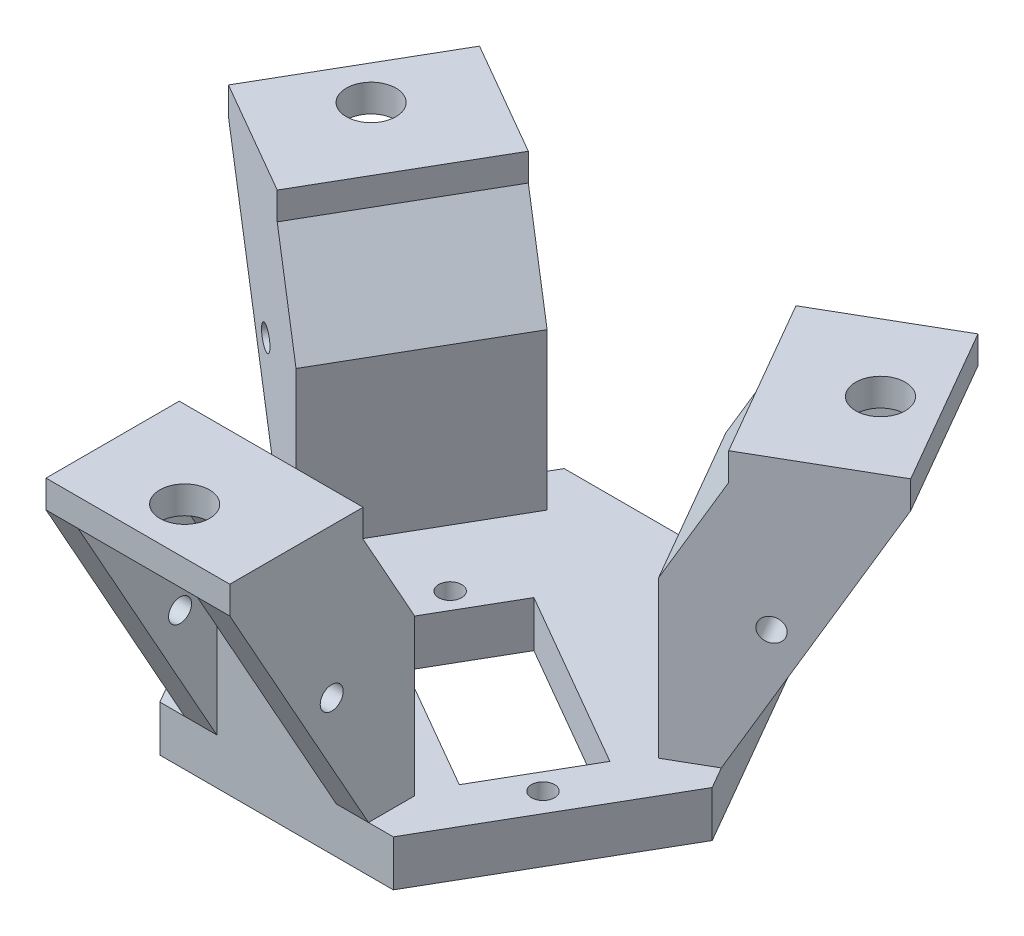
from build123d import *

# Parameters (mm, degrees)
BOSS_EXTRUDE1_DEPTH         = 5
SKETCH4_W                   = 20
SKETCH4_H                   = 5
BOSS_EXTRUDE3_DEPTH         = 17
BOSS_EXTRUDE2_START         = 6.5
SKETCH2_R                   = 1.25
BOSS_EXTRUDE2_DEPTH         = 3.5
CIRPATTERN1_COUNT           = 3
CIRPATTERN1_COPY_1_SKETCH_W = 20
CIRPATTERN1_COPY_1_SKETCH_H = 5
CIRPATTERN1_COPY_1_DEPTH    = 17
CIRPATTERN1_COPY_2_SKETCH_W = 20
CIRPATTERN1_COPY_2_SKETCH_H = 5
CIRPATTERN1_COPY_2_DEPTH    = 17
CIRPATTERN1_START           = 6.5
CIRPATTERN1_COPY_3_SKETCH_R = 1.25
CIRPATTERN1_COPY_3_DEPTH    = 3.5
CIRPATTERN1_COPY_4_SKETCH_R = 1.25
CIRPATTERN1_COPY_4_DEPTH    = 3.5
CUT_EXTRUDE1_REACH          = 50.2
CUT_EXTRUDE2_REACH          = 50.2
SKETCH6_R                   = 1.25
BOSS_EXTRUDE4_DEPTH         = 3
CUT_EXTRUDE3_REACH          = 61.959
SKETCH13_R                  = 2.7
CIRPATTERN2_COUNT           = 3


with BuildPart() as part:
    # Sketch1 → Boss-Extrude1 (new body)
    with BuildSketch(Plane(origin=(0, 0, 0), x_dir=(1, 0, 0), z_dir=(0, 1, 0))):
        Polygon((25.403411844, 0), (12.701705922, 22), (-12.701705922, 22), (-25.403411844, 0), (-12.701705922, -22), (12.701705922, -22), align=None)
    extrude(amount=BOSS_EXTRUDE1_DEPTH)

    # Sketch4 → Boss-Extrude3 (add)
    with BuildSketch(Plane(origin=(0, 5, 0), x_dir=(1, 0, 0), z_dir=(0, 1, 0))):
        with Locations((0, -19.5)):
            Rectangle(SKETCH4_W, SKETCH4_H)
    boss_extrude3 = extrude(amount=BOSS_EXTRUDE3_DEPTH)

    # Sketch2 → Boss-Extrude2 (add)
    with BuildSketch(Plane(origin=(0, 0, 0), x_dir=(0, 0, -1), z_dir=(1, 0, 0)).offset(BOSS_EXTRUDE2_START)):
        Polygon((-22, 22), (-22, 5), (-31.5, 22), align=None)
        with Locations(Location((-26, 18.75, 0), (0, 0, 180))):
            Circle(SKETCH2_R, mode=Mode.SUBTRACT)
    boss_extrude2 = extrude(amount=BOSS_EXTRUDE2_DEPTH)

    # Mirror1: Boss-Extrude3, Boss-Extrude2 across plane
    add(boss_extrude3.mirror(Plane(origin=(0, 0, 0), x_dir=(0, 0, 1), z_dir=(1, 0, 0))))
    add(boss_extrude2.mirror(Plane(origin=(0, 0, 0), x_dir=(0, 0, 1), z_dir=(1, 0, 0))))

    # CirPattern1: Boss-Extrude3, Boss-Extrude2 ×3 about axis
    cirpattern1_axis = Axis((0, 0, 0), (0, 1, 0))
    add([boss_extrude3.rotate(cirpattern1_axis, i * 360 / CIRPATTERN1_COUNT) for i in range(1, CIRPATTERN1_COUNT)])
    add([boss_extrude2.rotate(cirpattern1_axis, i * 360 / CIRPATTERN1_COUNT) for i in range(1, CIRPATTERN1_COUNT)])

    # CirPattern1 copy 1 sketch → CirPattern1 copy 1 (add)
    with BuildSketch(Plane(origin=(0, 5, 0), x_dir=(0.4999999999999998, 0, 0.8660254037844387), z_dir=(0, 1, 0))):
        with Locations((0, 19.5)):
            Rectangle(CIRPATTERN1_COPY_1_SKETCH_W, CIRPATTERN1_COPY_1_SKETCH_H)
    extrude(amount=CIRPATTERN1_COPY_1_DEPTH)

    # CirPattern1 copy 2 sketch → CirPattern1 copy 2 (add)
    with BuildSketch(Plane(origin=(0, 5, 0), x_dir=(0.5000000000000004, 0, -0.8660254037844384), z_dir=(0, 1, 0))):
        with Locations((0, 19.5)):
            Rectangle(CIRPATTERN1_COPY_2_SKETCH_W, CIRPATTERN1_COPY_2_SKETCH_H)
    extrude(amount=CIRPATTERN1_COPY_2_DEPTH)

    # CirPattern1 copy 3 sketch → CirPattern1 copy 3 (add)
    with BuildSketch(Plane(origin=(0, 0, 0), x_dir=(-0.8660254037844387, 0, 0.4999999999999998), z_dir=(0.4999999999999998, 0, 0.8660254037844387)).offset(CIRPATTERN1_START)):
        Polygon((-22, -22), (-22, -5), (-31.5, -22), align=None)
        with Locations((-26, -18.75)):
            Circle(CIRPATTERN1_COPY_3_SKETCH_R, mode=Mode.SUBTRACT)
    extrude(amount=CIRPATTERN1_COPY_3_DEPTH)

    # CirPattern1 copy 4 sketch → CirPattern1 copy 4 (add)
    with BuildSketch(Plane(origin=(0, 0, 0), x_dir=(0.8660254037844384, 0, 0.5000000000000004), z_dir=(0.5000000000000004, 0, -0.8660254037844384)).offset(CIRPATTERN1_START)):
        Polygon((-22, -22), (-22, -5), (-31.5, -22), align=None)
        with Locations((-26, -18.75)):
            Circle(CIRPATTERN1_COPY_4_SKETCH_R, mode=Mode.SUBTRACT)
    extrude(amount=CIRPATTERN1_COPY_4_DEPTH)

    # Sketch3 → Cut-Extrude1 (cut, up to next)
    with BuildSketch(Plane(origin=(0, 5, 0), x_dir=(1, 0, 0), z_dir=(0, 1, 0)), mode=Mode.PRIVATE) as cut_extrude1_sk1:
        Polygon((-2.196152423, 8.196152423), (17.376021703, -3.103847577), (11.376021703, -13.496152423), (-8.196152423, -2.196152423), align=None)
    cut_extrude1_tool1 = extrude(cut_extrude1_sk1.sketch, amount=-CUT_EXTRUDE1_REACH, mode=Mode.PRIVATE) & part.part
    add(cut_extrude1_tool1.solids().sort_by_distance((4.589935, 5, 2.65))[0], mode=Mode.SUBTRACT)

    # Sketch6 → Cut-Extrude2 (cut, up to next)
    with BuildSketch(Plane(origin=(0, 5, 0), x_dir=(1, 0, 0), z_dir=(0, 1, 0)), mode=Mode.PRIVATE) as cut_extrude2_sk1:
        with Locations(Location((-7.361215932, 4.25, 0), (0, 0, 270))):
            Circle(SKETCH6_R)
    cut_extrude2_tool1 = extrude(cut_extrude2_sk1.sketch, amount=-CUT_EXTRUDE2_REACH, mode=Mode.PRIVATE) & part.part
    # Sketch6 → Cut-Extrude2 (cut, up to next)
    with BuildSketch(Plane(origin=(0, 5, 0), x_dir=(1, 0, 0), z_dir=(0, 1, 0)), mode=Mode.PRIVATE) as cut_extrude2_sk2:
        with Locations(Location((16.541085212, -9.55, 0), (0, 0, 270))):
            Circle(SKETCH6_R)
    cut_extrude2_tool2 = extrude(cut_extrude2_sk2.sketch, amount=-CUT_EXTRUDE2_REACH, mode=Mode.PRIVATE) & part.part
    add(cut_extrude2_tool1.solids().sort_by_distance((-7.361216, 5, -4.25))[0], mode=Mode.SUBTRACT)
    add(cut_extrude2_tool2.solids().sort_by_distance((16.541085, 5, 9.55))[0], mode=Mode.SUBTRACT)

    # Sweep1: sweep along a path in Sketch11
    with BuildLine(Plane(origin=(-5, 0, 8.660254038), x_dir=(0.8660254037844364, 0, 0.5000000000000041), z_dir=(-0.500000000000004, 0, 0.8660254037844363))) as sweep1_path:
        Line((-31.5, 22), (-37.088235294, 32))
    # Sketch10 → Sweep1 (sweep)
    with BuildSketch(Plane(origin=(0, 22, 0), x_dir=(1, 0, 0), z_dir=(0, 1, 0))):
        Polygon((-22.279800219, 24.410254038), (-9.722431864, 17.160254038), (-19.722431864, -0.160254038), (-32.279800219, 7.089745962), (-30.529800219, 10.120834875), (-22.302558883, 5.370834875), (-15.802558883, 16.629165125), (-24.029800219, 21.379165125), align=None)
    sweep1 = sweep(path=sweep1_path.line)

    # Sketch12 → Boss-Extrude4 (add)
    with BuildSketch(Plane(origin=(0, 32, 0), x_dir=(1, 0, 0), z_dir=(0, 1, 0))):
        Polygon((-27.119353946, 27.204371685), (-14.561985591, 19.954371685), (-24.561985591, 2.633863609), (-37.119353946, 9.883863609), align=None)
    boss_extrude4 = extrude(amount=BOSS_EXTRUDE4_DEPTH)

    # Sketch13 → Cut-Extrude3 (cut, up to next)
    with BuildSketch(Plane(origin=(0, 35, 0), x_dir=(1, 0, 0), z_dir=(0, 1, 0)), mode=Mode.PRIVATE) as cut_extrude3_sk1:
        with Locations(Location((-27.712812921, 16, 0), (0, 0, 270))):
            Circle(SKETCH13_R)
    cut_extrude3_tool1 = extrude(cut_extrude3_sk1.sketch, amount=-CUT_EXTRUDE3_REACH, mode=Mode.PRIVATE) & part.part
    cut_extrude3 = cut_extrude3_tool1.solids().sort_by_distance((-27.712813, 35, -16))[0]
    add(cut_extrude3, mode=Mode.SUBTRACT)

    # CirPattern2: Sweep1, Boss-Extrude4, Cut-Extrude3 ×3 about axis
    cirpattern2_axis = Axis((0, 0, 0), (0, 1, 0))
    add([sweep1.rotate(cirpattern2_axis, i * 360 / CIRPATTERN2_COUNT) for i in range(1, CIRPATTERN2_COUNT)])
    add([boss_extrude4.rotate(cirpattern2_axis, i * 360 / CIRPATTERN2_COUNT) for i in range(1, CIRPATTERN2_COUNT)])
    add([cut_extrude3.rotate(cirpattern2_axis, i * 360 / CIRPATTERN2_COUNT) for i in range(1, CIRPATTERN2_COUNT)], mode=Mode.SUBTRACT)


solid = part.part
